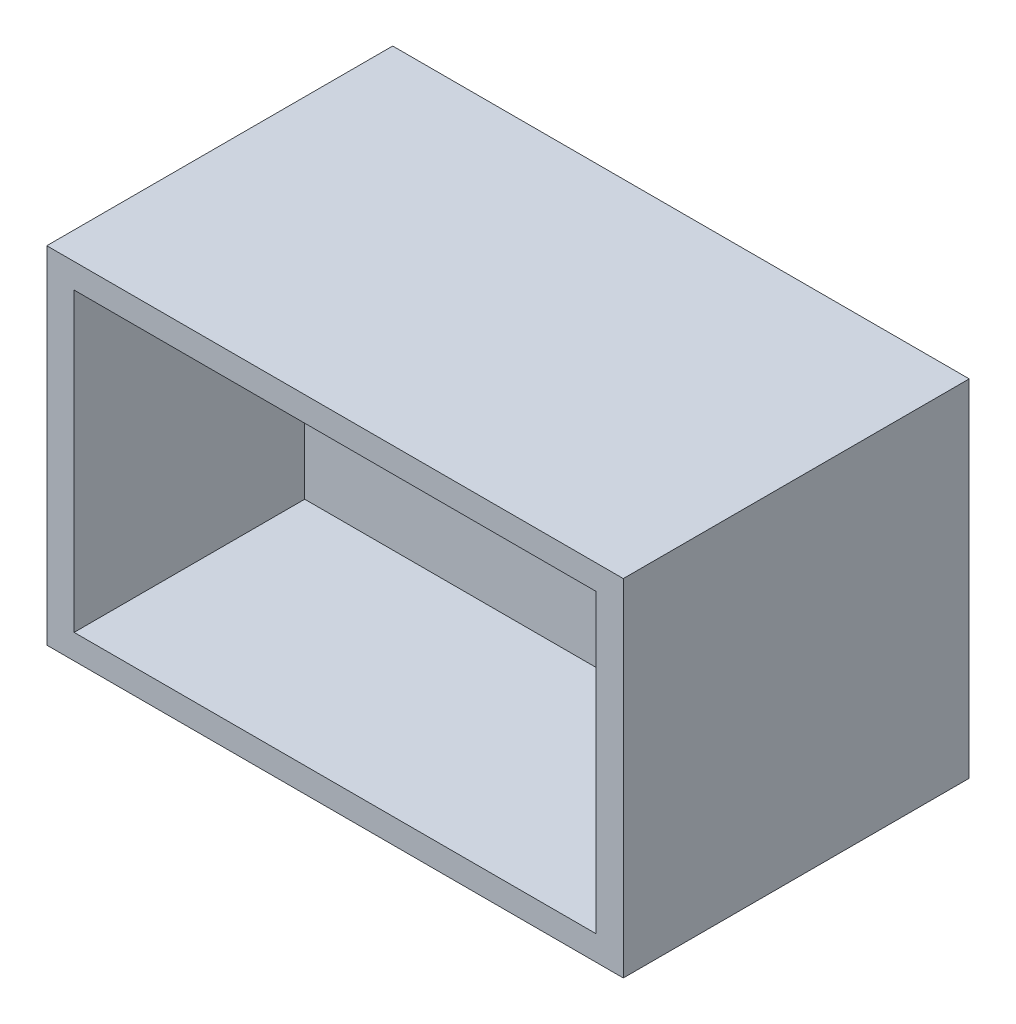
from build123d import *

# Parameters (mm, degrees)
SKETCH1_W           = 5
SKETCH1_H           = 3
BOSS_EXTRUDE1_DEPTH = 3
SKETCH3_W           = 4.52597082
SKETCH3_H           = 2.571205645
CUT_EXTRUDE1_DEPTH  = 2


with BuildPart() as part:
    # Sketch1 → Boss-Extrude1 (new body)
    with BuildSketch(Plane.XY):
        with Locations((0.65795708, -0.512205152)):
            Rectangle(SKETCH1_W, SKETCH1_H)
    extrude(amount=BOSS_EXTRUDE1_DEPTH)

    # Sketch3 → Cut-Extrude1 (cut)
    with BuildSketch(Plane.XY.offset(3)):
        with Locations((0.65795708, -0.512205152)):
            Rectangle(SKETCH3_W, SKETCH3_H)
    extrude(amount=-CUT_EXTRUDE1_DEPTH, mode=Mode.SUBTRACT)


solid = part.part
